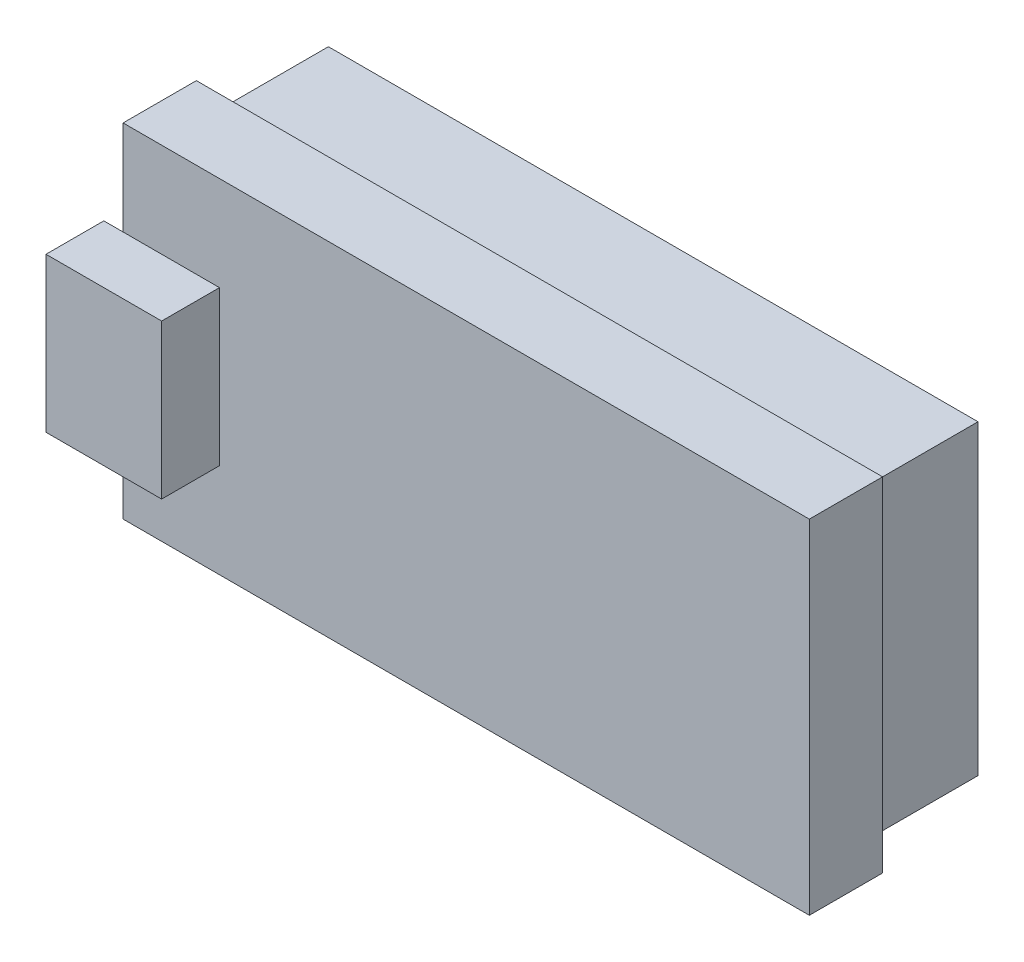
from build123d import *

# Parameters (mm, degrees)
SKETCH1_W           = 35.6
SKETCH1_H           = 17.8
BOSS_EXTRUDE1_DEPTH = 0.65
SKETCH2_W           = 6
SKETCH2_H           = 8
BOSS_EXTRUDE2_DEPTH = 3
BOSS_EXTRUDE3_DEPTH = 2.5
BOSS_EXTRUDE4_DEPTH = 6.1
CHAMFER1_SIZE       = 0.2


with BuildPart() as part:
    # Sketch1 → Boss-Extrude1 (new, symmetric)
    with BuildSketch(Plane.XY):
        Rectangle(SKETCH1_W, SKETCH1_H)
    extrude(amount=BOSS_EXTRUDE1_DEPTH, both=True)

    # Sketch2 → Boss-Extrude2 (add)
    with BuildSketch(Plane.XY.offset(0.65)):
        with Locations((-15.8, 0)):
            Rectangle(SKETCH2_W, SKETCH2_H)
    extrude(amount=BOSS_EXTRUDE2_DEPTH)

    # Sketch3 → Boss-Extrude3 (add)
    with BuildSketch(Plane(origin=(0, 0, -0.65), x_dir=(-1, 0, 0), z_dir=(0, 0, -1))):
        Polygon((17.8, 6.4), (-15.3, 6.4), (-15.3, -6.4), (17.8, -6.4), (17.8, -8.9), (-17.8, -8.9), (-17.8, 8.9), (17.8, 8.9), align=None)
    extrude(amount=BOSS_EXTRUDE3_DEPTH)

    # Sketch4 → Boss-Extrude4 (add)
    with BuildSketch(Plane(origin=(0, 0, -3.15), x_dir=(-1, 0, 0), z_dir=(0, 0, -1))):
        Polygon((16.85, -7.95), (16.85, -7.35), (-16.25, -7.35), (-16.25, 7.35), (16.85, 7.35), (16.85, 7.95), (-16.85, 7.95), (-16.85, -7.95), align=None)
    extrude(amount=BOSS_EXTRUDE4_DEPTH)

    # Chamfer1
    chamfer1_edges = [part.edges().sort_by_distance(p)[0] for p in [
        (0, -7.95, -9.25),
        (-16.85, -7.65, -9.25),
        (-0.3, -7.35, -9.25),
        (16.25, 0, -9.25),
        (-0.3, 7.35, -9.25),
        (-16.85, 7.65, -9.25),
        (0, 7.95, -9.25),
        (16.85, 0, -9.25),
    ]]
    chamfer(chamfer1_edges, length=CHAMFER1_SIZE)


solid = part.part
